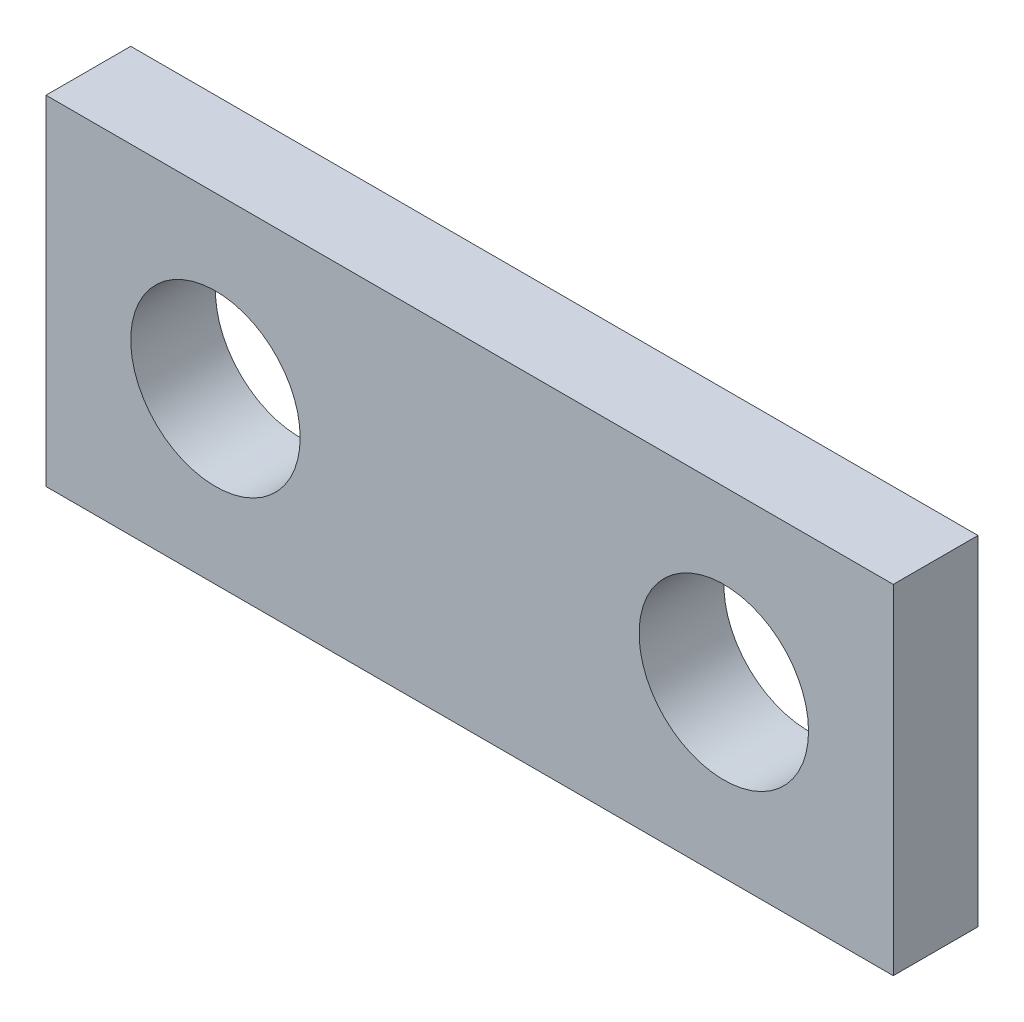
from build123d import *

# Parameters (mm, degrees)
SKETCH1_W           = 50
SKETCH1_H           = 20
SKETCH1_R           = 5
BOSS_EXTRUDE1_DEPTH = 5


with BuildPart() as part:
    # Sketch1 → Boss-Extrude1 (new body)
    with BuildSketch(Plane.XY):
        Rectangle(SKETCH1_W, SKETCH1_H)
        with Locations((15, 0)):
            Circle(SKETCH1_R, mode=Mode.SUBTRACT)
        with Locations((-15, 0)):
            Circle(SKETCH1_R, mode=Mode.SUBTRACT)
    extrude(amount=BOSS_EXTRUDE1_DEPTH)


solid = part.part
